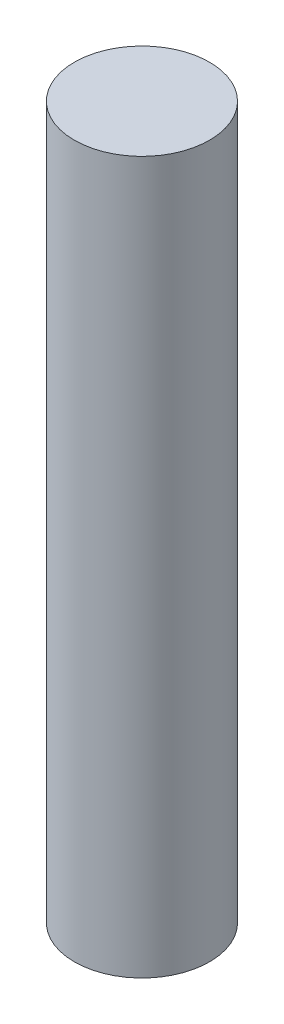
from build123d import *

# Parameters (mm, degrees)
SKETCH1_R           = 0.95
BOSS_EXTRUDE1_DEPTH = 5


with BuildPart() as part:
    # Sketch1 → Boss-Extrude1 (new, symmetric)
    with BuildSketch(Plane(origin=(0, 0, 0), x_dir=(1, 0, 0), z_dir=(0, 1, 0))):
        with Locations(Location((0, 0, 0), (0, 0, 270))):
            Circle(SKETCH1_R)
    extrude(amount=BOSS_EXTRUDE1_DEPTH, both=True)


solid = part.part
